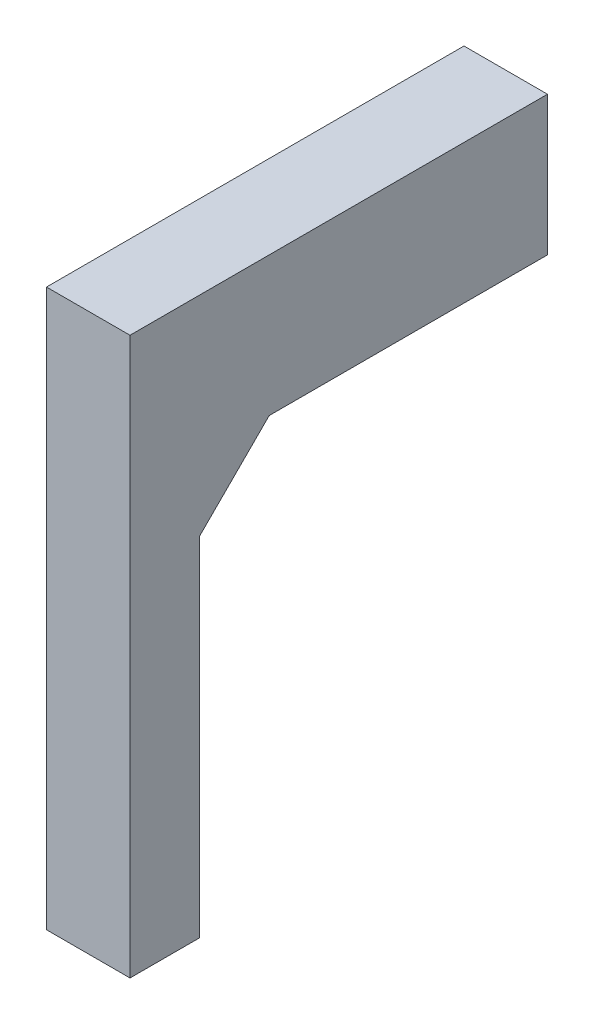
from build123d import *

# Parameters (mm, degrees)
BOSS_EXTRUDE1_DEPTH = 30


with BuildPart() as part:
    # Sketch2 → Boss-Extrude1 (new body)
    with BuildSketch(Plane.YZ):
        Polygon((0, 0), (0, 150), (-200, 150), (-200, 125), (-75, 125), (-50, 100), (-50, 0), align=None)
    extrude(amount=BOSS_EXTRUDE1_DEPTH)


solid = part.part
